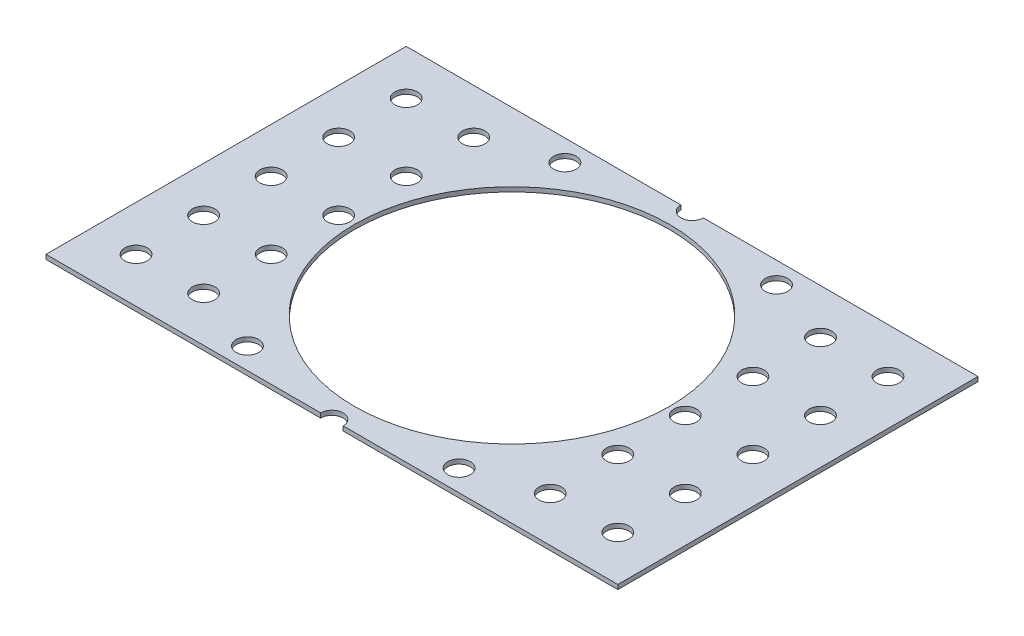
from build123d import *

# Parameters (mm, degrees)
SKETCH1_R           = 35
SKETCH1_R_2         = 2.5
BOSS_EXTRUDE1_DEPTH = 1


with BuildPart() as part:
    # Sketch1 → Boss-Extrude1 (new body)
    with BuildSketch(Plane(origin=(0, 0, 0), x_dir=(1, 0, 0), z_dir=(0, 1, 0))):
        with BuildLine():
            Line((-66.082817056, 25), (-5.082817056, 25))
            ThreePointArc((-5.082817056, 25), (-2.582817056, 22.520776659), (-0.082817056, 25))
            Line((-0.082817056, 25), (60.917182944, 25))
            Line((60.917182944, 25), (60.917182944, -55))
            Line((60.917182944, -55), (-0.082817056, -55))
            ThreePointArc((-0.082817056, -55), (-2.582817056, -52.5), (-5.082817056, -55))
            Line((-5.082817056, -55), (-66.082817056, -55))
            Line((-66.082817056, -55), (-66.082817056, 25))
        make_face()
        with Locations(Location((-2.582817056, -15, 0), (0, 0, 270))):
            Circle(SKETCH1_R, mode=Mode.SUBTRACT)
        with Locations(Location((-56.082817056, 15, 0), (0, 0, 270))):
            Circle(SKETCH1_R_2, mode=Mode.SUBTRACT)
        with Locations(Location((-41.082817056, 15, 0), (0, 0, 270))):
            Circle(SKETCH1_R_2, mode=Mode.SUBTRACT)
        with Locations(Location((-56.082817056, 0, 0), (0, 0, 270))):
            Circle(SKETCH1_R_2, mode=Mode.SUBTRACT)
        with Locations(Location((-41.082817056, 0, 0), (0, 0, 270))):
            Circle(SKETCH1_R_2, mode=Mode.SUBTRACT)
        with Locations(Location((-26.082817056, 20.252893574, 0), (0, 0, 270))):
            Circle(SKETCH1_R_2, mode=Mode.SUBTRACT)
        with Locations(Location((-56.082817056, -15, 0), (0, 0, 270))):
            Circle(SKETCH1_R_2, mode=Mode.SUBTRACT)
        with Locations(Location((-41.082817056, -15, 0), (0, 0, 270))):
            Circle(SKETCH1_R_2, mode=Mode.SUBTRACT)
        with Locations(Location((50.917182944, 15, 0), (0, 0, 90))):
            Circle(SKETCH1_R_2, mode=Mode.SUBTRACT)
        with Locations(Location((50.917182944, 0, 0), (0, 0, 90))):
            Circle(SKETCH1_R_2, mode=Mode.SUBTRACT)
        with Locations(Location((50.917182944, -15, 0), (0, 0, 90))):
            Circle(SKETCH1_R_2, mode=Mode.SUBTRACT)
        with Locations(Location((35.917182944, -15, 0), (0, 0, 90))):
            Circle(SKETCH1_R_2, mode=Mode.SUBTRACT)
        with Locations(Location((35.917182944, 0, 0), (0, 0, 90))):
            Circle(SKETCH1_R_2, mode=Mode.SUBTRACT)
        with Locations(Location((35.917182944, 15, 0), (0, 0, 90))):
            Circle(SKETCH1_R_2, mode=Mode.SUBTRACT)
        with Locations(Location((20.917182944, 20.252893574, 0), (0, 0, 90))):
            Circle(SKETCH1_R_2, mode=Mode.SUBTRACT)
        with Locations(Location((-26.082817056, -50.252893574, 0), (0, 0, 90))):
            Circle(SKETCH1_R_2, mode=Mode.SUBTRACT)
        with Locations(Location((-41.082817056, -45, 0), (0, 0, 90))):
            Circle(SKETCH1_R_2, mode=Mode.SUBTRACT)
        with Locations(Location((-41.082817056, -30, 0), (0, 0, 90))):
            Circle(SKETCH1_R_2, mode=Mode.SUBTRACT)
        with Locations(Location((-56.082817056, -30, 0), (0, 0, 90))):
            Circle(SKETCH1_R_2, mode=Mode.SUBTRACT)
        with Locations(Location((-56.082817056, -45, 0), (0, 0, 90))):
            Circle(SKETCH1_R_2, mode=Mode.SUBTRACT)
        with Locations(Location((50.917182944, -45, 0), (0, 0, 270))):
            Circle(SKETCH1_R_2, mode=Mode.SUBTRACT)
        with Locations(Location((50.917182944, -30, 0), (0, 0, 270))):
            Circle(SKETCH1_R_2, mode=Mode.SUBTRACT)
        with Locations(Location((35.917182944, -30, 0), (0, 0, 270))):
            Circle(SKETCH1_R_2, mode=Mode.SUBTRACT)
        with Locations(Location((35.917182944, -45, 0), (0, 0, 270))):
            Circle(SKETCH1_R_2, mode=Mode.SUBTRACT)
        with Locations(Location((20.917182944, -50.252893574, 0), (0, 0, 270))):
            Circle(SKETCH1_R_2, mode=Mode.SUBTRACT)
    extrude(amount=BOSS_EXTRUDE1_DEPTH)


solid = part.part
